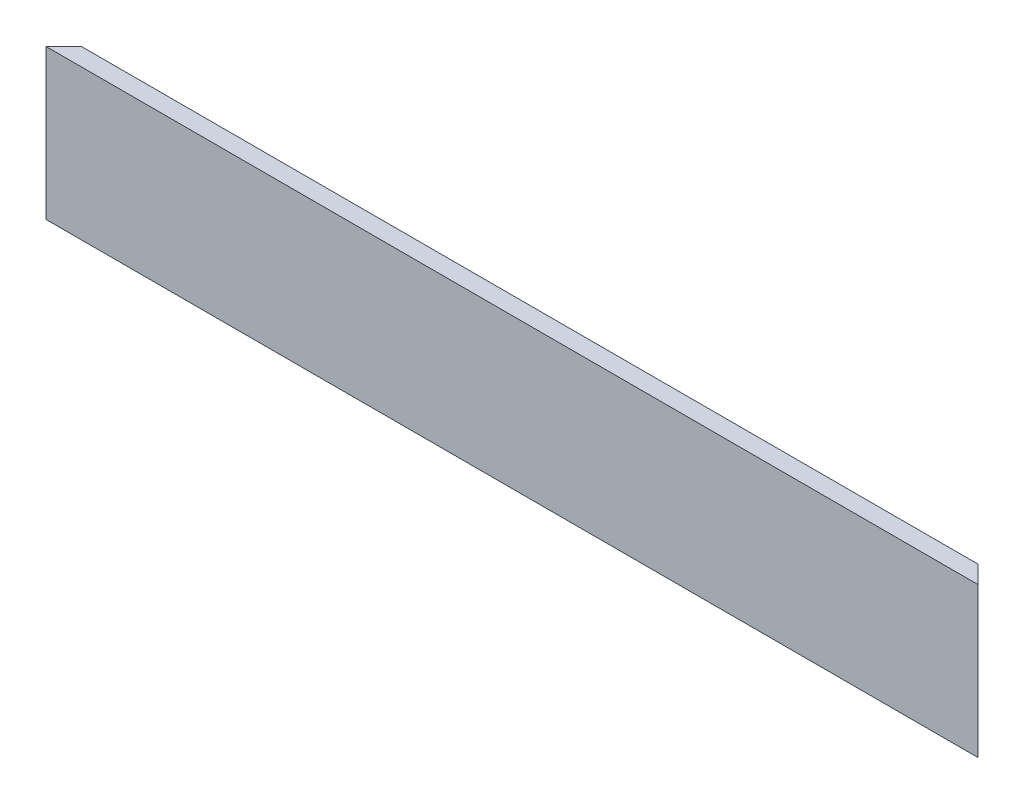
from build123d import *

# Parameters (mm, degrees)
SALIENTE_EXTRUIR1_DEPTH = 158
CORTAR_EXTRUIR3_DEPTH   = 105
CORTAR_EXTRUIR4_DEPTH   = 105


with BuildPart() as part:
    # Croquis1 → Saliente-Extruir1 (new body)
    with BuildSketch(Plane(origin=(0, 0, 0), x_dir=(0, 0, -1), z_dir=(1, 0, 0))):
        Polygon((-16.874298957, 6.35), (-16.874298957, -19.05), (8.525701043, -19.05), (8.525701043, -16.05), (-13.874298957, -16.05), (-13.874298957, 6.35), align=None)
    extrude(amount=SALIENTE_EXTRUIR1_DEPTH)

    # Croquis3 → Cortar-Extruir3 (cut)
    with BuildSketch(Plane(origin=(0, 6.35, 0), x_dir=(1, 0, 0), z_dir=(0, 1, 0))):
        Polygon((0, -16.874298957), (25.4, 8.525701043), (0, 8.525701043), align=None)
    extrude(amount=-CORTAR_EXTRUIR3_DEPTH, mode=Mode.SUBTRACT)

    # Croquis4 → Cortar-Extruir4 (cut)
    with BuildSketch(Plane(origin=(0, 6.35, 0), x_dir=(1, 0, 0), z_dir=(0, 1, 0))):
        Polygon((158, -16.874298957), (158, 8.525701043), (132.6, 8.525701043), align=None)
    extrude(amount=-CORTAR_EXTRUIR4_DEPTH, mode=Mode.SUBTRACT)


solid = part.part
